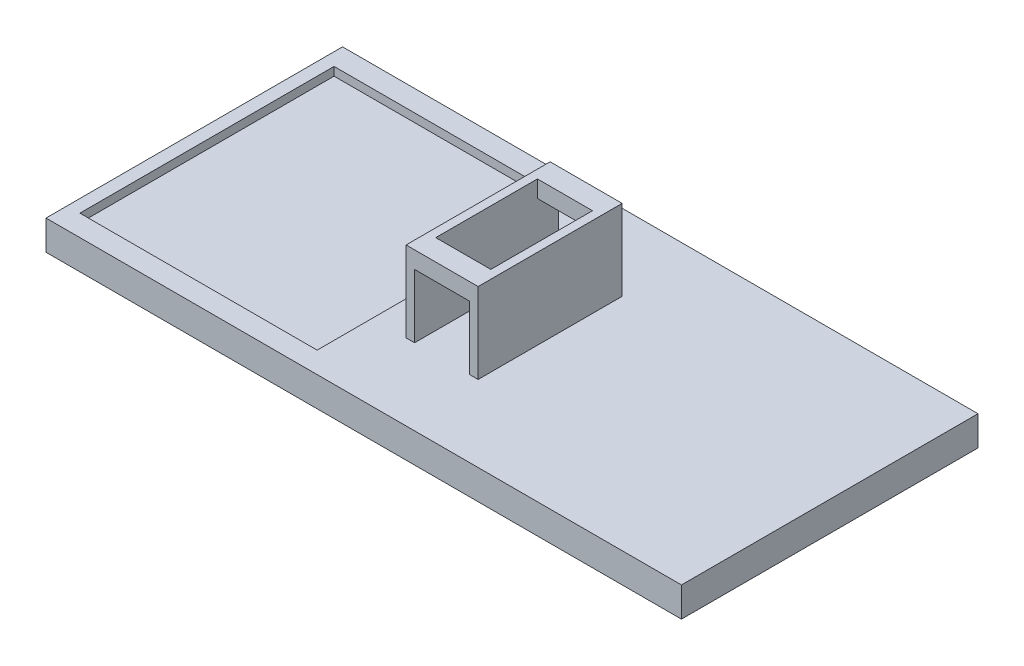
from build123d import *

# Parameters (mm, degrees)
EXTRUDE_3_DEPTH     = 5
SKETCH_2_6_W        = 56
SKETCH_2_6_H        = 60
EXTRUDE_4_DEPTH     = 7
SKETCH_4_W          = 56
SKETCH_4_H          = 60
EXTRUDE_5_DEPTH     = 5
EXTRUDE_6_DEPTH     = 19
SKETCH_7_W          = 13
SKETCH_7_H          = 15
CUT_EXTRUDE_1_DEPTH = 34


with BuildPart() as part:
    # Эскиз2 → Бобышка-Вытянуть3 (new body)
    with BuildSketch(Plane(origin=(0, 0, 0), x_dir=(1, 0, 0), z_dir=(0, 1, 0))):
        Polygon((0, 0), (150, 0), (150, 70), (0, 70), (0, 5), align=None)
    extrude(amount=EXTRUDE_3_DEPTH)

    # Эскиз2<6> → Бобышка-Вытянуть4 (add)
    with BuildSketch(Plane(origin=(0, 0, 0), x_dir=(1, 0, 0), z_dir=(0, 1, 0))):
        Polygon((0, 0), (150, 0), (150, 70), (0, 70), (0, 5), align=None)
        with Locations((31, 35)):
            Rectangle(SKETCH_2_6_W, SKETCH_2_6_H, mode=Mode.SUBTRACT)
    extrude(amount=EXTRUDE_4_DEPTH)

    # Эскиз4 → Бобышка-Вытянуть5 (add)
    with BuildSketch(Plane(origin=(0, 5, 0), x_dir=(1, 0, 0), z_dir=(0, 1, 0))):
        with Locations((31, 35)):
            Rectangle(SKETCH_4_W, SKETCH_4_H)
    extrude(amount=-EXTRUDE_5_DEPTH)

    # Эскиз5 → Бобышка-Вытянуть6 (add)
    with BuildSketch(Plane(origin=(0, 7, 0), x_dir=(1, 0, 0), z_dir=(0, 1, 0))):
        Polygon((84, 52), (69, 52), (67, 52), (67, 18), (84, 18), align=None)
        Polygon((69, 23), (69, 35), (69, 47), (82, 47), (82, 35), (82, 23), align=None, mode=Mode.SUBTRACT)
    extrude(amount=EXTRUDE_6_DEPTH)

    # Эскиз7 → Вырез-Вытянуть1 (cut)
    with BuildSketch(Plane.XY.offset(-18)):
        with Locations((75.5, 14.5)):
            Rectangle(SKETCH_7_W, SKETCH_7_H)
    extrude(amount=-CUT_EXTRUDE_1_DEPTH, mode=Mode.SUBTRACT)


solid = part.part
